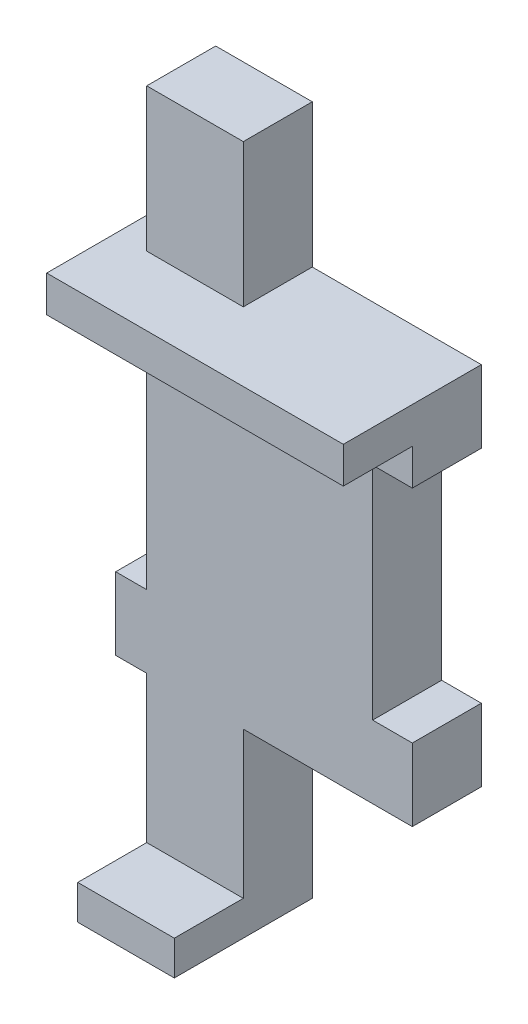
from build123d import *

# Parameters (mm, degrees)
SKETCH1_W               = 5.6
SKETCH1_H               = 40
BOSS_EXTRUDE1_DEPTH     = 4
SKETCH2_W               = 5.6
SKETCH2_H               = 2
BOSS_EXTRUDE2_DEPTH     = 4
SKETCH4_W               = 4
SKETCH4_H               = 4.2
BOSS_EXTRUDE3_DEPTH     = 1.8
MIRROR2_COPY_1_SKETCH_W = 4
MIRROR2_COPY_1_SKETCH_H = 4.2
MIRROR2_COPY_1_DEPTH    = 1.8
SKETCH8_W               = 4
SKETCH8_H               = 4.2
BOSS_EXTRUDE4_DEPTH     = 8
SKETCH9_W               = 17.2
SKETCH9_H               = 2.1
BOSS_EXTRUDE5_DEPTH     = 4
SKETCH10_W              = 4
SKETCH10_H              = 12.8
BOSS_EXTRUDE6_DEPTH     = 7.5
SKETCH11_R              = 1.5
CUT_EXTRUDE1_DEPTH      = 1


with BuildPart() as part:
    # Sketch1 → Boss-Extrude1 (new body)
    with BuildSketch(Plane.XY):
        Rectangle(SKETCH1_W, SKETCH1_H)
    extrude(amount=BOSS_EXTRUDE1_DEPTH)

    # Sketch2 → Boss-Extrude2 (add)
    with BuildSketch(Plane.XY.offset(4)):
        with Locations((0, -19)):
            Rectangle(SKETCH2_W, SKETCH2_H)
    extrude(amount=BOSS_EXTRUDE2_DEPTH)

    # Sketch4 → Boss-Extrude3 (add)
    with BuildSketch(Plane.ZY.offset(2.8)):
        with Locations((2, 9.6)):
            Rectangle(SKETCH4_W, SKETCH4_H)
    boss_extrude3 = extrude(amount=BOSS_EXTRUDE3_DEPTH)

    # Mirror1: Boss-Extrude3 across plane
    add(boss_extrude3.mirror(Plane.ZY))

    # Mirror2: Boss-Extrude3 across plane
    add(boss_extrude3.mirror(Plane(origin=(0, 1.1, 0), x_dir=(0, 0, 1), z_dir=(0, -1, 0))))

    # Mirror2 copy 1 sketch → Mirror2 copy 1 (add)
    with BuildSketch(Plane(origin=(2.8, 2.2, 0), x_dir=(0, 0, 1), z_dir=(1, 0, 0))):
        with Locations((2, 9.6)):
            Rectangle(MIRROR2_COPY_1_SKETCH_W, MIRROR2_COPY_1_SKETCH_H)
    extrude(amount=MIRROR2_COPY_1_DEPTH)

    # Sketch8 → Boss-Extrude4 (add)
    with BuildSketch(Plane(origin=(4.6, 0, 0), x_dir=(0, 0, -1), z_dir=(1, 0, 0))):
        with Locations((-2, 9.6)):
            Rectangle(SKETCH8_W, SKETCH8_H)
        with Locations((-2, -7.4)):
            Rectangle(SKETCH8_W, SKETCH8_H)
    extrude(amount=BOSS_EXTRUDE4_DEPTH)

    # Sketch9 → Boss-Extrude5 (add)
    with BuildSketch(Plane.XY.offset(4)):
        with Locations((4, 10.65)):
            Rectangle(SKETCH9_W, SKETCH9_H)
    extrude(amount=BOSS_EXTRUDE5_DEPTH)

    # Sketch10 → Boss-Extrude6 (add)
    with BuildSketch(Plane(origin=(2.8, 0, 0), x_dir=(0, 0, -1), z_dir=(1, 0, 0))):
        with Locations((-2, 1.1)):
            Rectangle(SKETCH10_W, SKETCH10_H)
    extrude(amount=BOSS_EXTRUDE6_DEPTH)

    # Sketch11 → Cut-Extrude1 (cut)
    with BuildSketch(Plane(origin=(0, 0, 0), x_dir=(-1, 0, 0), z_dir=(0, 0, -1))):
        with Locations((-4.9, 1.1)):
            Circle(SKETCH11_R)
    extrude(amount=-CUT_EXTRUDE1_DEPTH, mode=Mode.SUBTRACT)


solid = part.part
